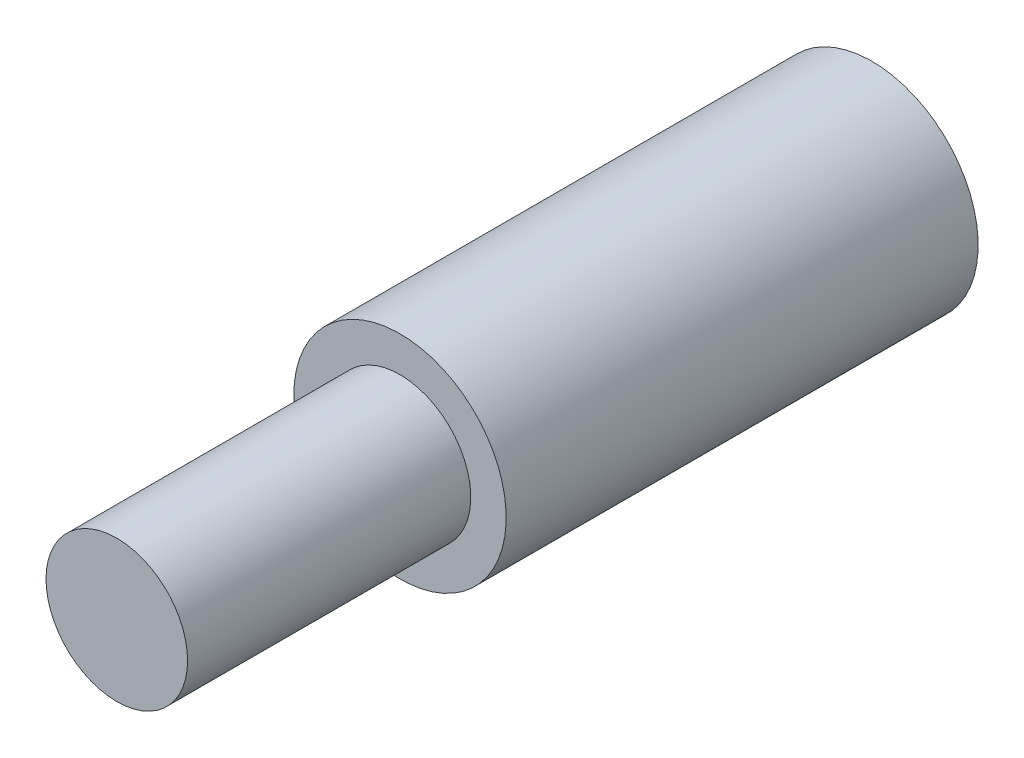
from build123d import *

# Parameters (mm, degrees)
SKETCH1_R           = 1.5
BOSS_EXTRUDE1_DEPTH = 6
SKETCH2_R           = 2.25
BOSS_EXTRUDE2_DEPTH = 10
SKETCH3_R           = 1.5
CUT_EXTRUDE1_DEPTH  = 4


with BuildPart() as part:
    # Sketch1 → Boss-Extrude1 (new body)
    with BuildSketch(Plane.XY):
        Circle(SKETCH1_R)
    extrude(amount=BOSS_EXTRUDE1_DEPTH)

    # Sketch2 → Boss-Extrude2 (add)
    with BuildSketch(Plane(origin=(0, 0, 0), x_dir=(-1, 0, 0), z_dir=(0, 0, -1))):
        Circle(SKETCH2_R)
    extrude(amount=BOSS_EXTRUDE2_DEPTH)

    # Sketch3 → Cut-Extrude1 (cut)
    with BuildSketch(Plane(origin=(0, 0, -10), x_dir=(-1, 0, 0), z_dir=(0, 0, -1))):
        Circle(SKETCH3_R)
    extrude(amount=-CUT_EXTRUDE1_DEPTH, mode=Mode.SUBTRACT)


solid = part.part
